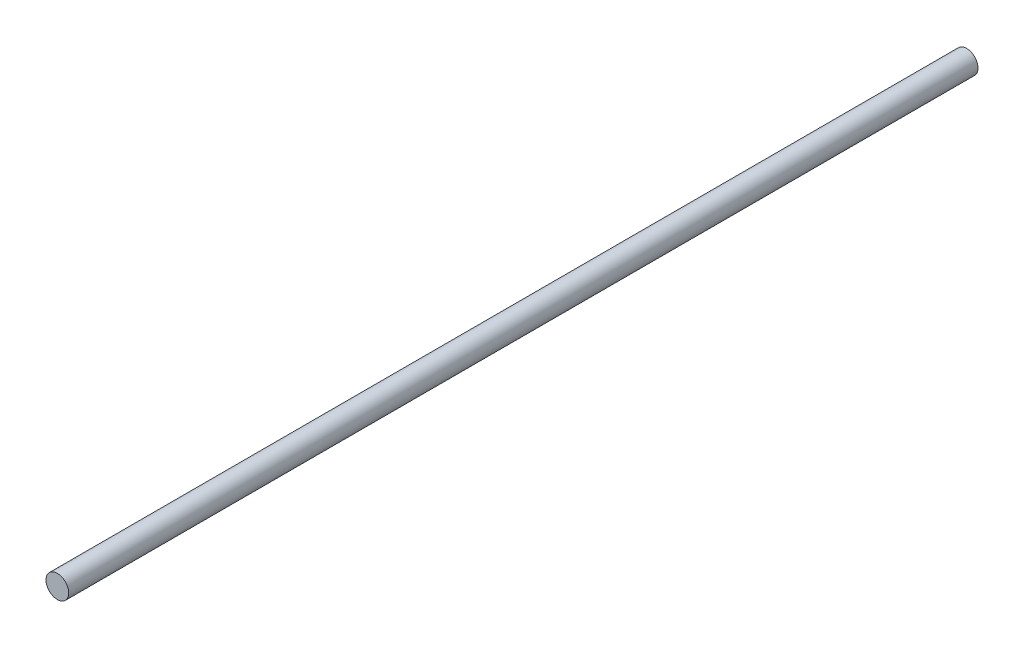
from build123d import *

# Parameters (mm, degrees)
SKETCH1_R           = 7.5
BOSS_EXTRUDE1_DEPTH = 600


with BuildPart() as part:
    # Sketch1 → Boss-Extrude1 (new body)
    with BuildSketch(Plane.XY):
        Circle(SKETCH1_R)
    extrude(amount=BOSS_EXTRUDE1_DEPTH)


solid = part.part
